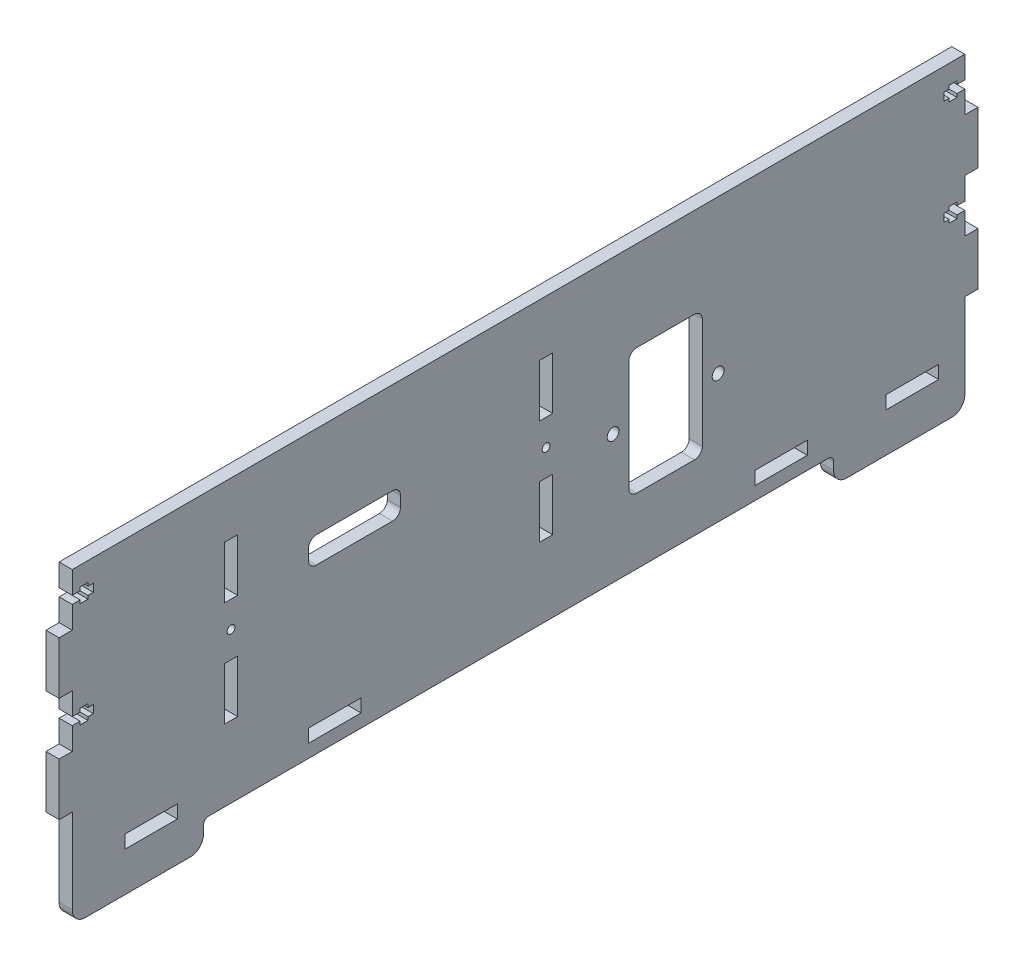
from build123d import *

# Parameters (mm, degrees)
SKETCH_1_R      = 2.25
SKETCH_1_R_2    = 1.5
SKETCH_1_W      = 5
SKETCH_1_H      = 20
SKETCH_1_W_2    = 20
SKETCH_1_H_2    = 5
EXTRUDE_1_DEPTH = 5


with BuildPart() as part:
    # 草图1 → 凸台-拉伸1 (new body)
    with BuildSketch(Plane(origin=(0, 0, 0), x_dir=(0, 0, -1), z_dir=(1, 0, 0))):
        with BuildLine():
            Line((-168.536416178, -19.716908756), (-168.536416178, -16.716908756))
            ThreePointArc((-168.536416178, -16.716908756), (-167.950629741, -15.302695194), (-166.536416178, -14.716908756))
            Line((-166.536416178, -14.716908756), (69.463583822, -14.716908756))
            ThreePointArc((69.463583822, -14.716908756), (70.877797384, -15.302695194), (71.463583822, -16.716908756))
            Line((71.463583822, -16.716908756), (71.463583822, -19.716908756))
            ThreePointArc((71.463583822, -19.716908756), (72.928049916, -23.252442662), (76.463583822, -24.716908756))
            Line((76.463583822, -24.716908756), (116.463583822, -24.716908756))
            ThreePointArc((116.463583822, -24.716908756), (119.999117728, -23.252442662), (121.463583822, -19.716908756))
            Line((121.463583822, -19.716908756), (121.463583822, 12.583091244))
            Line((121.463583822, 12.583091244), (126.463583822, 12.583091244))
            Line((126.463583822, 12.583091244), (126.463583822, 32.583091244))
            Line((126.463583822, 32.583091244), (121.463583822, 32.583091244))
            Line((121.463583822, 32.583091244), (121.463583822, 41.083091244))
            Line((121.463583822, 41.083091244), (118.463583822, 41.083091244))
            Line((118.463583822, 41.083091244), (118.463583822, 39.833091244))
            Line((118.463583822, 39.833091244), (115.463583822, 39.833091244))
            Line((115.463583822, 39.833091244), (115.463583822, 41.083091244))
            Line((115.463583822, 41.083091244), (113.463583822, 41.083091244))
            Line((113.463583822, 41.083091244), (113.463583822, 44.083091244))
            Line((113.463583822, 44.083091244), (115.463583822, 44.083091244))
            Line((115.463583822, 44.083091244), (115.463583822, 45.333091244))
            Line((115.463583822, 45.333091244), (118.463583822, 45.333091244))
            Line((118.463583822, 45.333091244), (118.463583822, 44.083091244))
            Line((118.463583822, 44.083091244), (121.463583822, 44.083091244))
            Line((121.463583822, 44.083091244), (121.463583822, 52.583091244))
            Line((121.463583822, 52.583091244), (126.463583822, 52.583091244))
            Line((126.463583822, 52.583091244), (126.463583822, 72.583091244))
            Line((126.463583822, 72.583091244), (121.463583822, 72.583091244))
            Line((121.463583822, 72.583091244), (121.463583822, 81.083091244))
            Line((121.463583822, 81.083091244), (118.463583822, 81.083091244))
            Line((118.463583822, 81.083091244), (118.463583822, 79.833091244))
            Line((118.463583822, 79.833091244), (115.463583822, 79.833091244))
            Line((115.463583822, 79.833091244), (115.463583822, 81.083091244))
            Line((115.463583822, 81.083091244), (113.463583822, 81.083091244))
            Line((113.463583822, 81.083091244), (113.463583822, 84.083091244))
            Line((113.463583822, 84.083091244), (115.463583822, 84.083091244))
            Line((115.463583822, 84.083091244), (115.463583822, 85.333091244))
            Line((115.463583822, 85.333091244), (118.463583822, 85.333091244))
            Line((118.463583822, 85.333091244), (118.463583822, 84.083091244))
            Line((118.463583822, 84.083091244), (121.463583822, 84.083091244))
            Line((121.463583822, 84.083091244), (121.463583822, 92.583091244))
            Line((121.463583822, 92.583091244), (-218.536416178, 92.583091244))
            Line((-218.536416178, 92.583091244), (-218.536416178, 84.083091244))
            Line((-218.536416178, 84.083091244), (-215.536416178, 84.083091244))
            Line((-215.536416178, 84.083091244), (-215.536416178, 85.333091244))
            Line((-215.536416178, 85.333091244), (-212.536416178, 85.333091244))
            Line((-212.536416178, 85.333091244), (-212.536416178, 84.083091244))
            Line((-212.536416178, 84.083091244), (-210.536416178, 84.083091244))
            Line((-210.536416178, 84.083091244), (-210.536416178, 81.083091244))
            Line((-210.536416178, 81.083091244), (-212.536416178, 81.083091244))
            Line((-212.536416178, 81.083091244), (-212.536416178, 79.833091244))
            Line((-212.536416178, 79.833091244), (-215.536416178, 79.833091244))
            Line((-215.536416178, 79.833091244), (-215.536416178, 81.083091244))
            Line((-215.536416178, 81.083091244), (-218.536416178, 81.083091244))
            Line((-218.536416178, 81.083091244), (-218.536416178, 72.583091244))
            Line((-218.536416178, 72.583091244), (-223.536416178, 72.583091244))
            Line((-223.536416178, 72.583091244), (-223.536416178, 52.583091244))
            Line((-223.536416178, 52.583091244), (-218.536416178, 52.583091244))
            Line((-218.536416178, 52.583091244), (-218.536416178, 44.083091244))
            Line((-218.536416178, 44.083091244), (-215.536416178, 44.083091244))
            Line((-215.536416178, 44.083091244), (-215.536416178, 45.333091244))
            Line((-215.536416178, 45.333091244), (-212.536416178, 45.333091244))
            Line((-212.536416178, 45.333091244), (-212.536416178, 44.083091244))
            Line((-212.536416178, 44.083091244), (-210.536416178, 44.083091244))
            Line((-210.536416178, 44.083091244), (-210.536416178, 41.083091244))
            Line((-210.536416178, 41.083091244), (-212.536416178, 41.083091244))
            Line((-212.536416178, 41.083091244), (-212.536416178, 39.833091244))
            Line((-212.536416178, 39.833091244), (-215.536416178, 39.833091244))
            Line((-215.536416178, 39.833091244), (-215.536416178, 41.083091244))
            Line((-215.536416178, 41.083091244), (-218.536416178, 41.083091244))
            Line((-218.536416178, 41.083091244), (-218.536416178, 32.583091244))
            Line((-218.536416178, 32.583091244), (-223.536416178, 32.583091244))
            Line((-223.536416178, 32.583091244), (-223.536416178, 12.583091244))
            Line((-223.536416178, 12.583091244), (-218.536416178, 12.583091244))
            Line((-218.536416178, 12.583091244), (-218.536416178, -19.716908756))
            ThreePointArc((-218.536416178, -19.716908756), (-217.071950084, -23.252442662), (-213.536416178, -24.716908756))
            Line((-213.536416178, -24.716908756), (-173.536416178, -24.716908756))
            ThreePointArc((-173.536416178, -24.716908756), (-170.000882272, -23.252442662), (-168.536416178, -19.716908756))
        make_face()
        with Locations((27.463583822, 34.283091244)):
            Circle(SKETCH_1_R, mode=Mode.SUBTRACT)
        with Locations((-12.536416178, 34.283091244)):
            Circle(SKETCH_1_R, mode=Mode.SUBTRACT)
        with Locations((-38.036416178, 42.583091244)):
            Circle(SKETCH_1_R_2, mode=Mode.SUBTRACT)
        with Locations((-158.036416178, 42.583091244)):
            Circle(SKETCH_1_R_2, mode=Mode.SUBTRACT)
        with Locations((-38.036416178, 62.583091244)):
            Rectangle(SKETCH_1_W, SKETCH_1_H, mode=Mode.SUBTRACT)
        with Locations((-38.036416178, 22.583091244)):
            Rectangle(SKETCH_1_W, SKETCH_1_H, mode=Mode.SUBTRACT)
        with Locations((-158.036416178, 62.583091244)):
            Rectangle(SKETCH_1_W, SKETCH_1_H, mode=Mode.SUBTRACT)
        with Locations((-158.036416178, 22.583091244)):
            Rectangle(SKETCH_1_W, SKETCH_1_H, mode=Mode.SUBTRACT)
        with Locations((-118.536416178, -7.216908756)):
            Rectangle(SKETCH_1_W_2, SKETCH_1_H_2, mode=Mode.SUBTRACT)
        with Locations((-188.536416178, -7.216908756)):
            Rectangle(SKETCH_1_W_2, SKETCH_1_H_2, mode=Mode.SUBTRACT)
        with Locations((101.463583822, -7.216908756)):
            Rectangle(SKETCH_1_W_2, SKETCH_1_H_2, mode=Mode.SUBTRACT)
        with Locations((51.463583822, -7.216908756)):
            Rectangle(SKETCH_1_W_2, SKETCH_1_H_2, mode=Mode.SUBTRACT)
        with BuildLine():
            Line((18.463583822, 58.283091244), (-3.536416178, 58.283091244))
            ThreePointArc((-3.536416178, 58.283091244), (-5.657736522, 57.404411587), (-6.536416178, 55.283091244))
            Line((-6.536416178, 55.283091244), (-6.536416178, 13.283091244))
            ThreePointArc((-6.536416178, 13.283091244), (-5.657736522, 11.1617709), (-3.536416178, 10.283091244))
            Line((-3.536416178, 10.283091244), (18.463583822, 10.283091244))
            ThreePointArc((18.463583822, 10.283091244), (20.584904165, 11.1617709), (21.463583822, 13.283091244))
            Line((21.463583822, 13.283091244), (21.463583822, 55.283091244))
            ThreePointArc((21.463583822, 55.283091244), (20.584904165, 57.404411587), (18.463583822, 58.283091244))
        make_face(mode=Mode.SUBTRACT)
        with BuildLine():
            Line((-125.536416178, 57.583091244), (-96.536416178, 57.583091244))
            ThreePointArc((-96.536416178, 57.583091244), (-94.415095835, 56.704411587), (-93.536416178, 54.583091244))
            Line((-93.536416178, 54.583091244), (-93.536416178, 50.583091244))
            ThreePointArc((-93.536416178, 50.583091244), (-94.415095835, 48.4617709), (-96.536416178, 47.583091244))
            Line((-96.536416178, 47.583091244), (-125.536416178, 47.583091244))
            ThreePointArc((-125.536416178, 47.583091244), (-127.657736522, 48.4617709), (-128.536416178, 50.583091244))
            Line((-128.536416178, 50.583091244), (-128.536416178, 54.583091244))
            ThreePointArc((-128.536416178, 54.583091244), (-127.657736522, 56.704411587), (-125.536416178, 57.583091244))
        make_face(mode=Mode.SUBTRACT)
    extrude(amount=EXTRUDE_1_DEPTH)


solid = part.part
